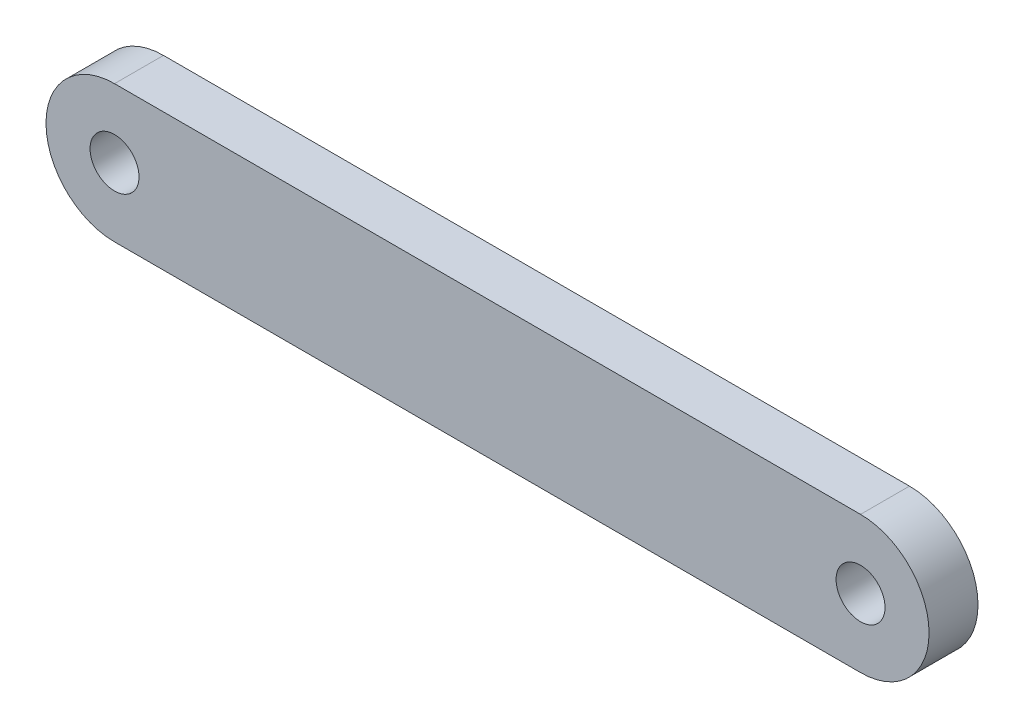
from build123d import *

# Parameters (mm, degrees)
SKETCH1_R           = 3.175
BOSS_EXTRUDE1_DEPTH = 6.35


with BuildPart() as part:
    # Sketch1 → Boss-Extrude1 (new body)
    with BuildSketch(Plane.XY):
        with BuildLine():
            Line((-49.444208902, -8.773302225), (47.343791098, -8.773302225))
            ThreePointArc((47.343791098, -8.773302225), (56.233791098, 0.116697775), (47.343791098, 9.006697775))
            Line((47.343791098, 9.006697775), (-49.444208902, 9.006697775))
            ThreePointArc((-49.444208902, 9.006697775), (-58.334208902, 0.116697775), (-49.444208902, -8.773302225))
        make_face()
        with Locations((-49.444208902, 0.116697775)):
            Circle(SKETCH1_R, mode=Mode.SUBTRACT)
        with Locations((47.343791098, 0.116697775)):
            Circle(SKETCH1_R, mode=Mode.SUBTRACT)
    extrude(amount=BOSS_EXTRUDE1_DEPTH)


solid = part.part
